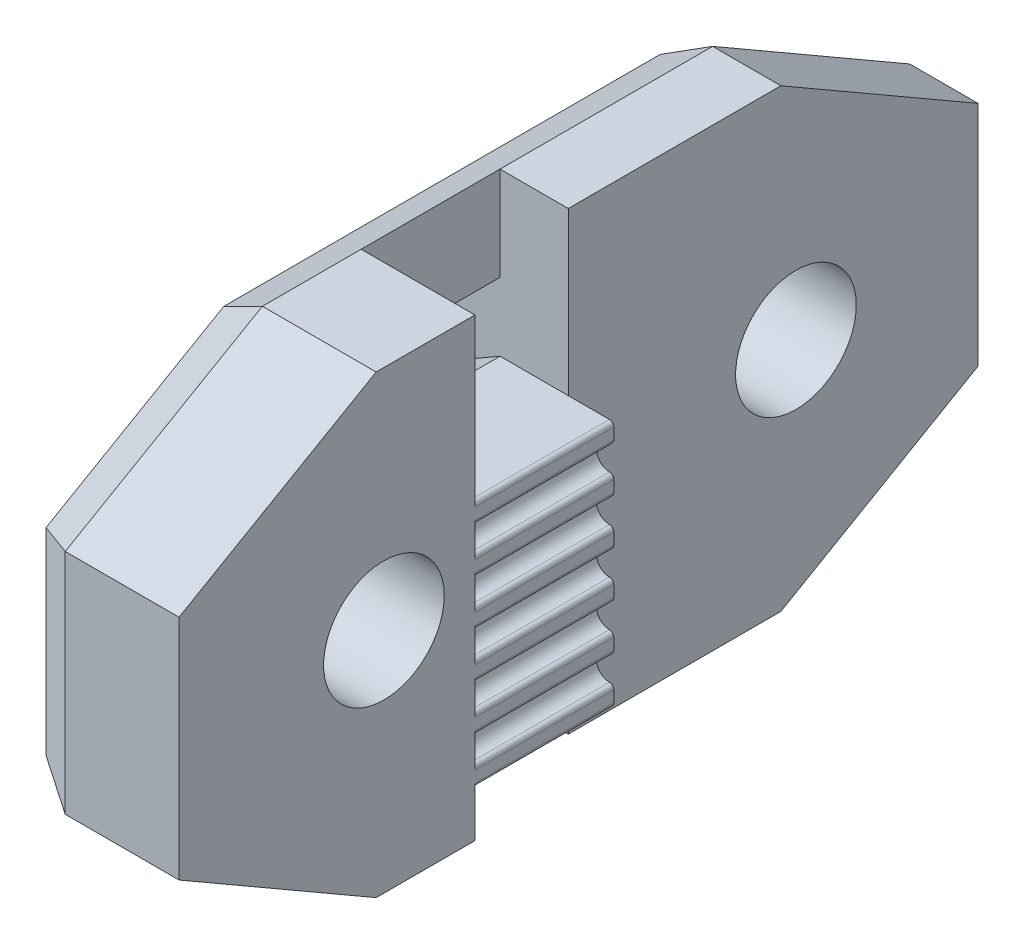
from build123d import *
from OCP.BRepFilletAPI import BRepFilletAPI_MakeChamfer

# Parameters (mm, degrees)
AUFSATZ_LINEAR_AUSTRAGEN1_DEPTH   = 6.1
AUFSATZ_LINEAR_AUSTRAGEN1_2_DEPTH = 6.1
SKIZZE2_W                         = 6
SKIZZE2_H                         = 10.88
SCHNITT_LINEAR_AUSTRAGEN1_DEPTH   = 6.1
SKIZZE3_R                         = 2.65
SKIZZE3_W                         = 6.1
SKIZZE3_H                         = 4.12
AUFSATZ_LINEAR_AUSTRAGEN2_DEPTH   = 2.19
SKIZZE4_R                         = 2.65
AUFSATZ_LINEAR_AUSTRAGEN3_DEPTH   = 4.81
SKIZZE5_R                         = 2.65
AUFSATZ_LINEAR_AUSTRAGEN4_DEPTH   = 0.19
FASE1_SIZE                        = 5
FASE1_SIZE2                       = 8.660254038
FASE2_SIZE                        = 2
FASE2_SIZE2                       = 1.154700538
SCHNITT_LINEAR_START              = -4
SCHNITT_LINEAR_AUSTRAGEN3_DEPTH   = 2.5
SCHNITT_LINEAR_AUSTRAGEN4_REACH   = 67.9
SKIZZE12_W                        = 5
SKIZZE12_H                        = 6.1


with BuildPart() as part:
    # Skizze1 → Aufsatz-Linear austragen1 (new body)
    with BuildSketch(Plane.XY):
        Polygon((0, 0), (0, 9.44), (0, 10.88), (-6, 10.88), (-6, 0), align=None)
    extrude(amount=AUFSATZ_LINEAR_AUSTRAGEN1_DEPTH)

    # Skizze2 → Schnitt-Linear austragen1 (cut)
    with BuildSketch(Plane.XY.offset(6.1)):
        with Locations((-3, 5.44)):
            Rectangle(SKIZZE2_W, SKIZZE2_H)
    extrude(amount=-SCHNITT_LINEAR_AUSTRAGEN1_DEPTH, mode=Mode.SUBTRACT)


with BuildPart() as body_2:
    # Skizze1 → Aufsatz-Linear austragen1 2 (new body)
    with BuildSketch(Plane.XY):
        with BuildLine():
            Line((-7.05, 10.19), (-7.05, 10.69))
            ThreePointArc((-7.05, 10.69), (-7.105649712, 10.824350288), (-7.24, 10.88))
            Line((-7.24, 10.88), (-9.24, 10.88))
            Line((-9.24, 10.88), (-9.24, 0))
            Line((-9.24, 0), (-7.24, 0))
            ThreePointArc((-7.24, 0), (-7.105649712, 0.055649712), (-7.05, 0.19))
            Line((-7.05, 0.19), (-7.05, 0.69))
            ThreePointArc((-7.05, 0.69), (-7.105649712, 0.824350288), (-7.24, 0.88))
            ThreePointArc((-7.24, 0.88), (-7.8, 1.44), (-7.24, 2))
            ThreePointArc((-7.24, 2), (-7.105649712, 2.055649712), (-7.05, 2.19))
            Line((-7.05, 2.19), (-7.05, 2.69))
            ThreePointArc((-7.05, 2.69), (-7.105649712, 2.824350288), (-7.24, 2.88))
            ThreePointArc((-7.24, 2.88), (-7.8, 3.44), (-7.24, 4))
            ThreePointArc((-7.24, 4), (-7.105649712, 4.055649712), (-7.05, 4.19))
            Line((-7.05, 4.19), (-7.05, 4.69))
            ThreePointArc((-7.05, 4.69), (-7.105649712, 4.824350288), (-7.24, 4.88))
            ThreePointArc((-7.24, 4.88), (-7.8, 5.44), (-7.24, 6))
            ThreePointArc((-7.24, 6), (-7.105649712, 6.055649712), (-7.05, 6.19))
            Line((-7.05, 6.19), (-7.05, 6.69))
            ThreePointArc((-7.05, 6.69), (-7.105649712, 6.824350288), (-7.24, 6.88))
            ThreePointArc((-7.24, 6.88), (-7.8, 7.44), (-7.24, 8))
            ThreePointArc((-7.24, 8), (-7.105649712, 8.055649712), (-7.05, 8.19))
            Line((-7.05, 8.19), (-7.05, 8.69))
            ThreePointArc((-7.05, 8.69), (-7.105649712, 8.824350288), (-7.24, 8.88))
            ThreePointArc((-7.24, 8.88), (-7.8, 9.44), (-7.24, 10))
            ThreePointArc((-7.24, 10), (-7.105649712, 10.055649712), (-7.05, 10.19))
        make_face()
    extrude(amount=AUFSATZ_LINEAR_AUSTRAGEN1_2_DEPTH)

    # Skizze3 → Aufsatz-Linear austragen2 (add)
    # profile 1 of 2: a face of its own
    with BuildSketch(Plane.ZY.offset(9.24)):
        Polygon((-13, -2), (0, -2), (0, 13.88), (0, 18), (-13, 18), align=None)
        with Locations((-4, 8)):
            Circle(SKIZZE3_R, mode=Mode.SUBTRACT)
    # profile 2 of 2: a face of its own
    with BuildSketch(Plane.ZY.offset(9.24)):
        with Locations((3.05, 15.94)):
            Rectangle(SKIZZE3_W, SKIZZE3_H)
    extrude(amount=-AUFSATZ_LINEAR_AUSTRAGEN2_DEPTH)

    # Skizze4 → Aufsatz-Linear austragen3 (add)
    # profile 1 of 2: a face of its own
    with BuildSketch(Plane.ZY.offset(9.24)):
        Polygon((24.1, 18), (6.1, 18), (6.1, 13.88), (6.1, 10.88), (6.1, 0), (6.1, -2), (24.1, -2), align=None)
        with Locations((16.1, 8)):
            Circle(SKIZZE4_R, mode=Mode.SUBTRACT)
    # profile 2 of 2: a face of its own
    with BuildSketch(Plane.ZY.offset(9.24)):
        Polygon((6.1, 0), (6.1, 10.88), (0, 10.88), (0, 13.88), (6.1, 13.88), (6.1, 18), (-13, 18), (-13, -2), (0, -2), (0, 0), align=None)
        with Locations((-4, 8)):
            Circle(SKIZZE4_R, mode=Mode.SUBTRACT)
    extrude(amount=AUFSATZ_LINEAR_AUSTRAGEN3_DEPTH)

    # Skizze5 → Aufsatz-Linear austragen4 (add)
    with BuildSketch(Plane(origin=(-9.24, 0, 0), x_dir=(0, 0, -1), z_dir=(1, 0, 0))):
        Polygon((-6.1, 13.88), (-6.1, 18), (-24.1, 18), (-24.1, -2), (-6.1, -2), (-6.1, 0), (-6.1, 10.88), align=None)
        with Locations(Location((-16.1, 8, 0), (0, 0, 180))):
            Circle(SKIZZE5_R, mode=Mode.SUBTRACT)
    extrude(amount=AUFSATZ_LINEAR_AUSTRAGEN4_DEPTH)

    # Fase1: one chamfer whose edges measure the first distance from different faces: ONE call of the kernel's chamfer builder (chamfer() names one face for all edges)
    fase1_edges_1 = [body_2.edges().sort_by_distance(p)[0] for p in [
        (-11.645, -2, 24.1),
        (-11.645, 18, 24.1),
    ]]
    fase1_side_1 = [body_2.faces().sort_by_distance(p)[0] for p in [
        (-11.645, 8, 24.1),
    ]]
    fase1_edges_2 = [body_2.edges().sort_by_distance(p)[0] for p in [
        (-10.55, -2, -13),
        (-10.55, 18, -13),
    ]]
    fase1_side_2 = [body_2.faces().sort_by_distance(p)[0] for p in [
        (-10.55, 8, -13),
    ]]
    fase1 = BRepFilletAPI_MakeChamfer(body_2.part.solid().wrapped)
    for e in fase1_edges_1:
        fase1.Add(FASE1_SIZE, FASE1_SIZE2, e.wrapped, fase1_side_1[0].wrapped)  # the first distance lies on this face
    for e in fase1_edges_2:
        fase1.Add(FASE1_SIZE, FASE1_SIZE2, e.wrapped, fase1_side_2[0].wrapped)  # the first distance lies on this face
    add(Compound.cast(fase1.Shape()), mode=Mode.REPLACE)

    # Fase2: one chamfer whose edges measure the first distance from different faces: ONE call of the kernel's chamfer builder (chamfer() names one face for all edges)
    fase2_edges_1 = [body_2.edges().sort_by_distance(p)[0] for p in [
        (-14.05, -2, 10.769872981),
    ]]
    fase2_side_1 = [body_2.faces().sort_by_distance(p)[0] for p in [
        (-11.645, -2, 10.769872981),
    ]]
    fase2_edges_2 = [body_2.edges().sort_by_distance(p)[0] for p in [
        (-14.05, 10.88, 3.05),
    ]]
    fase2_side_2 = [body_2.faces().sort_by_distance(p)[0] for p in [
        (-11.645, 10.88, 3.05),
    ]]
    fase2_edges_3 = [body_2.edges().sort_by_distance(p)[0] for p in [
        (-14.05, 13.88, 3.05),
    ]]
    fase2_side_3 = [body_2.faces().sort_by_distance(p)[0] for p in [
        (-10.55, 13.88, 3.05),
    ]]
    fase2_edges_4 = [body_2.edges().sort_by_distance(p)[0] for p in [
        (-14.05, 18, 5.55),
    ]]
    fase2_side_4 = [body_2.faces().sort_by_distance(p)[0] for p in [
        (-10.939880768, 18, 4.735948766),
    ]]
    fase2_edges_5 = [body_2.edges().sort_by_distance(p)[0] for p in [
        (-14.05, 8, 24.1),
    ]]
    fase2_side_5 = [body_2.faces().sort_by_distance(p)[0] for p in [
        (-11.645, 8, 24.1),
    ]]
    fase2_edges_6 = [body_2.edges().sort_by_distance(p)[0] for p in [
        (-14.05, 8, -13),
    ]]
    fase2_side_6 = [body_2.faces().sort_by_distance(p)[0] for p in [
        (-10.55, 8, -13),
    ]]
    fase2_edges_7 = [body_2.edges().sort_by_distance(p)[0] for p in [
        (-14.05, -2, -2.169872981),
    ]]
    fase2_side_7 = [body_2.faces().sort_by_distance(p)[0] for p in [
        (-10.55, -2, -2.169872981),
    ]]
    fase2_edges_8 = [body_2.edges().sort_by_distance(p)[0] for p in [
        (-14.05, 0.5, -8.669872981),
    ]]
    fase2_side_8 = [body_2.faces().sort_by_distance(p)[0] for p in [
        (-10.55, 0.5, -8.669872981),
    ]]
    fase2_edges_9 = [body_2.edges().sort_by_distance(p)[0] for p in [
        (-14.05, 0.5, 19.769872981),
    ]]
    fase2_side_9 = [body_2.faces().sort_by_distance(p)[0] for p in [
        (-11.645, 0.5, 19.769872981),
    ]]
    fase2_edges_10 = [body_2.edges().sort_by_distance(p)[0] for p in [
        (-14.05, 15.5, 19.769872981),
    ]]
    fase2_side_10 = [body_2.faces().sort_by_distance(p)[0] for p in [
        (-11.645, 15.5, 19.769872981),
    ]]
    fase2_edges_11 = [body_2.edges().sort_by_distance(p)[0] for p in [
        (-14.05, 15.5, -8.669872981),
    ]]
    fase2_side_11 = [body_2.faces().sort_by_distance(p)[0] for p in [
        (-10.55, 15.5, -8.669872981),
    ]]
    fase2 = BRepFilletAPI_MakeChamfer(body_2.part.solid().wrapped)
    for e in fase2_edges_1:
        fase2.Add(FASE2_SIZE, FASE2_SIZE2, e.wrapped, fase2_side_1[0].wrapped)  # the first distance lies on this face
    for e in fase2_edges_2:
        fase2.Add(FASE2_SIZE, FASE2_SIZE2, e.wrapped, fase2_side_2[0].wrapped)  # the first distance lies on this face
    for e in fase2_edges_3:
        fase2.Add(FASE2_SIZE, FASE2_SIZE2, e.wrapped, fase2_side_3[0].wrapped)  # the first distance lies on this face
    for e in fase2_edges_4:
        fase2.Add(FASE2_SIZE, FASE2_SIZE2, e.wrapped, fase2_side_4[0].wrapped)  # the first distance lies on this face
    for e in fase2_edges_5:
        fase2.Add(FASE2_SIZE, FASE2_SIZE2, e.wrapped, fase2_side_5[0].wrapped)  # the first distance lies on this face
    for e in fase2_edges_6:
        fase2.Add(FASE2_SIZE, FASE2_SIZE2, e.wrapped, fase2_side_6[0].wrapped)  # the first distance lies on this face
    for e in fase2_edges_7:
        fase2.Add(FASE2_SIZE, FASE2_SIZE2, e.wrapped, fase2_side_7[0].wrapped)  # the first distance lies on this face
    for e in fase2_edges_8:
        fase2.Add(FASE2_SIZE, FASE2_SIZE2, e.wrapped, fase2_side_8[0].wrapped)  # the first distance lies on this face
    for e in fase2_edges_9:
        fase2.Add(FASE2_SIZE, FASE2_SIZE2, e.wrapped, fase2_side_9[0].wrapped)  # the first distance lies on this face
    for e in fase2_edges_10:
        fase2.Add(FASE2_SIZE, FASE2_SIZE2, e.wrapped, fase2_side_10[0].wrapped)  # the first distance lies on this face
    for e in fase2_edges_11:
        fase2.Add(FASE2_SIZE, FASE2_SIZE2, e.wrapped, fase2_side_11[0].wrapped)  # the first distance lies on this face
    add(Compound.cast(fase2.Shape()), mode=Mode.REPLACE)

    # Skizze11 → Schnitt-Linear austragen3 (cut)
    with BuildSketch(Plane.XZ.offset(2).offset(SCHNITT_LINEAR_START)):
        with BuildLine():
            Line((-14.05, 7.6), (-14.05, 6.1))
            ThreePointArc((-14.05, 6.1), (-12.989339828, 5.660660172), (-12.55, 4.6))
            Line((-12.55, 4.6), (-12.55, 1.5))
            ThreePointArc((-12.55, 1.5), (-12.989339828, 0.439339828), (-14.05, 0))
            Line((-14.05, 0), (-14.05, -1.5))
            ThreePointArc((-14.05, -1.5), (-11.928679656, -0.621320344), (-11.05, 1.5))
            Line((-11.05, 1.5), (-11.05, 4.6))
            ThreePointArc((-11.05, 4.6), (-11.928679656, 6.721320344), (-14.05, 7.6))
        make_face()
    extrude(amount=-SCHNITT_LINEAR_AUSTRAGEN3_DEPTH, mode=Mode.SUBTRACT)


with BuildPart() as body_2_2:
    # Spiegeln1: mirrored copy
    add(body_2.part.mirror(Plane(origin=(-63.197479165, -24.924466517, 24.1), x_dir=(1, 0, 0), z_dir=(0, 0, 1))))

    # Schnitt-Linear austragen4: up to this plane
    schnitt_linear_austragen4_end = Plane(origin=(-14.05, 15.034700538, 42.1), z_dir=(0.4999999999999981, 0.8660254037844397, 0))
    # Skizze12 → Schnitt-Linear austragen4 (cut, up to the surface)
    with BuildSketch(Plane(origin=(0, 18, 0), x_dir=(1, 0, 0), z_dir=(0, 1, 0)), mode=Mode.PRIVATE) as schnitt_linear_austragen4_sk1:
        with Locations((-9.55, -45.15)):
            Rectangle(SKIZZE12_W, SKIZZE12_H)
    schnitt_linear_austragen4_tool1 = split(extrude(schnitt_linear_austragen4_sk1.sketch, amount=-SCHNITT_LINEAR_AUSTRAGEN4_REACH, mode=Mode.PRIVATE), bisect_by=schnitt_linear_austragen4_end, keep=Keep.BOTH, mode=Mode.PRIVATE)
    add(schnitt_linear_austragen4_tool1.solids().sort_by_distance((-9.55, 18, 45.15))[0], mode=Mode.SUBTRACT)


solid = body_2_2.part
